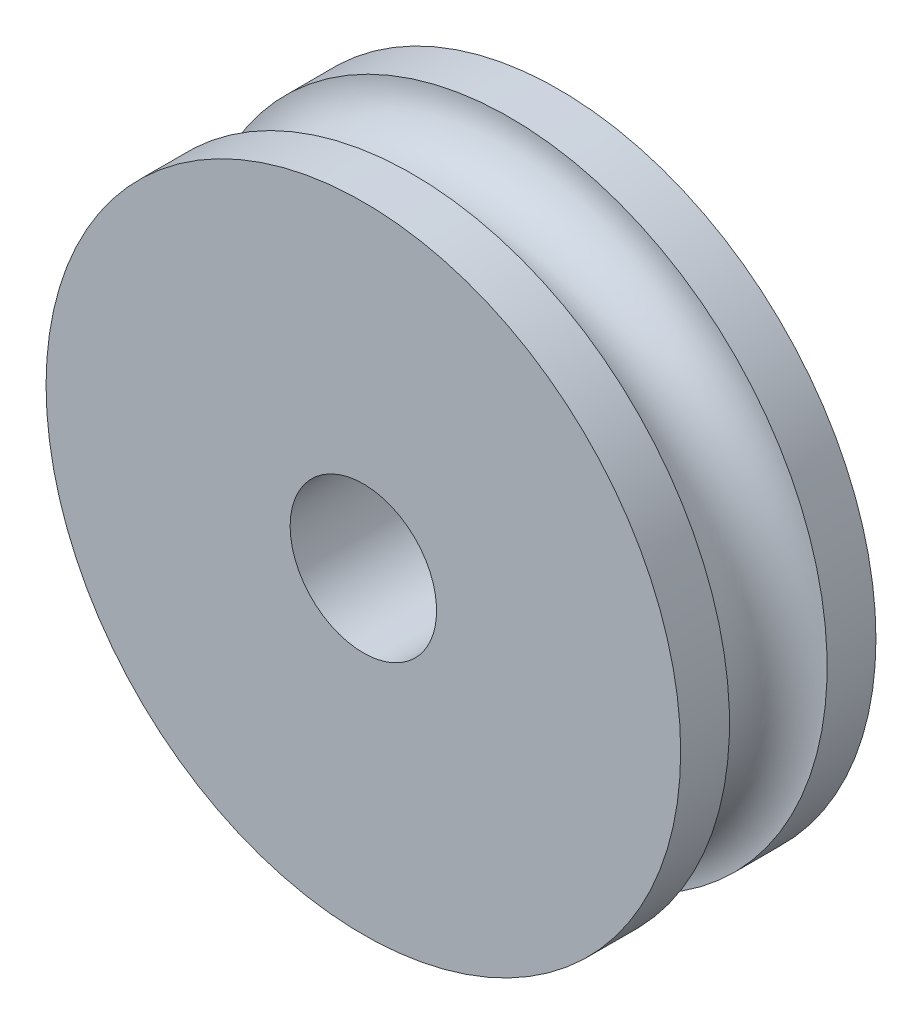
from build123d import *

# Parameters (mm, degrees)
SKETCH1_R           = 6.5
BOSS_EXTRUDE1_DEPTH = 4
SKETCH5_R           = 1.5
CUT_EXTRUDE1_DEPTH  = 4


with BuildPart() as part:
    # Sketch1 → Boss-Extrude1 (new body)
    with BuildSketch(Plane.XY):
        Circle(SKETCH1_R)
    extrude(amount=BOSS_EXTRUDE1_DEPTH)

    # Sketch4 → Cut-Revolve1 (revolve, cut)
    with BuildSketch(Plane(origin=(0, 0, 0), x_dir=(0, -1, 0), z_dir=(1, 0, 0)), mode=Mode.PRIVATE) as cut_revolve1_sk:
        with BuildLine():
            Line((6.5, -1), (6.5, -3))
            ThreePointArc((6.5, -3), (5.5, -2), (6.5, -1))
        make_face()
    revolve(cut_revolve1_sk.sketch.rotate(Axis((0, 0, 0), (0, 0, 1)), 270), axis=Axis((0, 0, 0), (0, 0, 1)), mode=Mode.SUBTRACT)

    # Sketch5 → Cut-Extrude1 (cut)
    with BuildSketch(Plane(origin=(0, 0, 0), x_dir=(-1, 0, 0), z_dir=(0, 0, -1))):
        Circle(SKETCH5_R)
    extrude(amount=-CUT_EXTRUDE1_DEPTH, mode=Mode.SUBTRACT)


solid = part.part
